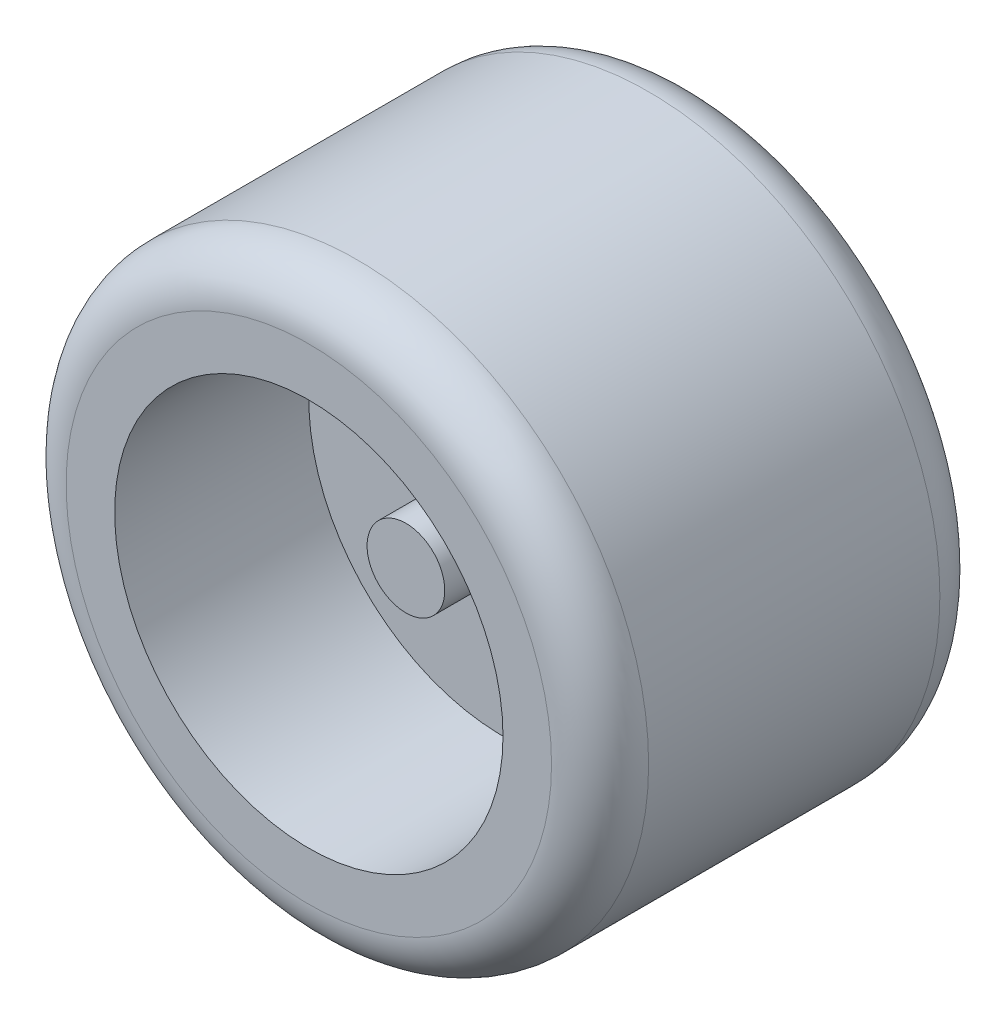
from build123d import *

# Parameters (mm, degrees)
SKETCH1_R           = 15
BOSS_EXTRUDE1_DEPTH = 20
SKETCH2_R           = 10
CUT_EXTRUDE1_DEPTH  = 10
CUT_EXTRUDE3_START  = -2
SKETCH3_R           = 10
CUT_EXTRUDE3_DEPTH  = 2
SKETCH4_R           = 2
BOSS_EXTRUDE2_DEPTH = 5
BOSS_EXTRUDE3_START = 2
SKETCH5_R           = 2
BOSS_EXTRUDE3_DEPTH = 2
FILLET2_R           = 2.5
FILLET3_R           = 2.5


with BuildPart() as part:
    # Sketch1 → Boss-Extrude1 (new body)
    with BuildSketch(Plane.XY):
        Circle(SKETCH1_R)
    extrude(amount=BOSS_EXTRUDE1_DEPTH)

    # Sketch2 → Cut-Extrude1 (cut)
    with BuildSketch(Plane.XY.offset(20)):
        Circle(SKETCH2_R)
    extrude(amount=-CUT_EXTRUDE1_DEPTH, mode=Mode.SUBTRACT)

    # Sketch3 → Cut-Extrude3 (cut)
    with BuildSketch(Plane(origin=(0, 0, 0), x_dir=(-1, 0, 0), z_dir=(0, 0, -1)).offset(CUT_EXTRUDE3_START)):
        Circle(SKETCH3_R)
    extrude(amount=CUT_EXTRUDE3_DEPTH, mode=Mode.SUBTRACT)

    # Sketch4 → Boss-Extrude2 (add)
    with BuildSketch(Plane.XY.offset(10)):
        Circle(SKETCH4_R)
    extrude(amount=BOSS_EXTRUDE2_DEPTH)

    # Sketch5 → Boss-Extrude3 (add)
    with BuildSketch(Plane(origin=(0, 0, 2), x_dir=(-1, 0, 0), z_dir=(0, 0, -1)).offset(BOSS_EXTRUDE3_START)):
        Circle(SKETCH5_R)
    extrude(amount=-BOSS_EXTRUDE3_DEPTH)

    # Fillet2
    fillet2_edges = [part.edges().sort_by_distance(p)[0] for p in [
        (-15, 0, 20),
    ]]
    fillet(fillet2_edges, radius=FILLET2_R)

    # Fillet3
    fillet3_edges = [part.edges().sort_by_distance(p)[0] for p in [
        (-15, 0, 0),
    ]]
    fillet(fillet3_edges, radius=FILLET3_R)


solid = part.part
